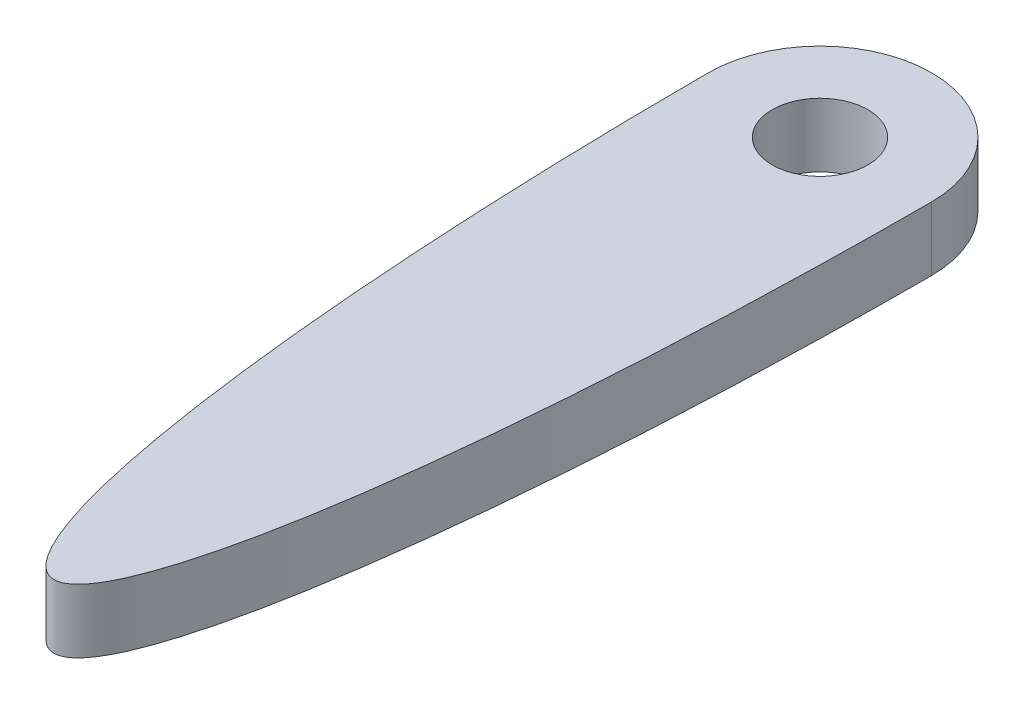
from build123d import *

# Parameters (mm, degrees)
SKETCH1_R           = 5.55625
SKETCH1_R_2         = 2.38125
BOSS_EXTRUDE1_DEPTH = 3.175


with BuildPart() as part:
    # Sketch1 → Boss-Extrude1 (new body)
    # profile 1 of 2: a face of its own
    with BuildSketch(Plane(origin=(0, 0, 0), x_dir=(1, 0, 0), z_dir=(0, 1, 0))):
        with BuildLine():
            add(Edge.make_bspline(
                [(-5.55625, 0), (-5.55625, -38.1), (0, -38.1), (5.55625, -38.1), (5.55625, 0)],
                knots=[1.570796327, 1.570796327, 1.570796327, 3.141592654, 3.141592654, 4.71238898, 4.71238898, 4.71238898], degree=2, weights=[1, 0.707106781, 1, 0.707106781, 1]))
            ThreePointArc((5.55625, 0), (0, -5.55625), (-5.55625, 0))
        make_face()
    # profile 2 of 2: a face of its own
    with BuildSketch(Plane(origin=(0, 0, 0), x_dir=(1, 0, 0), z_dir=(0, 1, 0))):
        Circle(SKETCH1_R)
        with Locations(Location((0, 0, 0), (0, 0, 270))):
            Circle(SKETCH1_R_2, mode=Mode.SUBTRACT)
    extrude(amount=BOSS_EXTRUDE1_DEPTH)


solid = part.part
